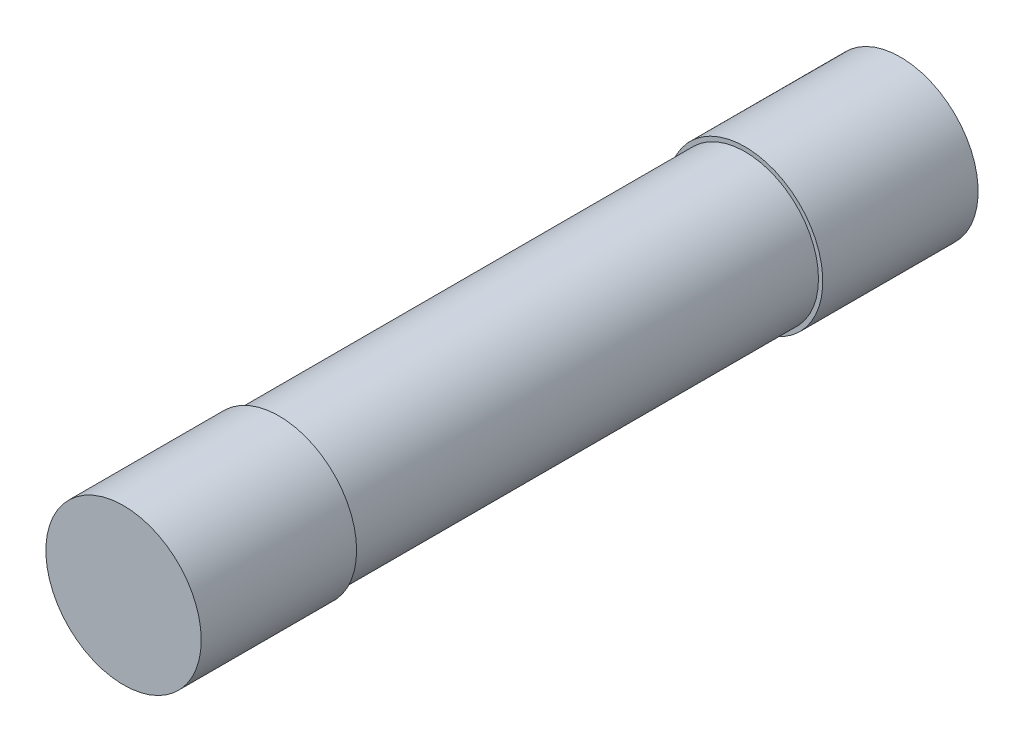
from build123d import *

# Parameters (mm, degrees)
SKETCH1_R           = 3.175
BOSS_EXTRUDE1_DEPTH = 6.35
SKETCH2_R           = 3
BOSS_EXTRUDE2_DEPTH = 19.05
SKETCH3_R           = 3.175
BOSS_EXTRUDE3_DEPTH = 6.35


with BuildPart() as part:
    # Sketch1 → Boss-Extrude1 (new body)
    with BuildSketch(Plane.XY):
        Circle(SKETCH1_R)
    extrude(amount=BOSS_EXTRUDE1_DEPTH)


with BuildPart() as body_2:
    # Sketch2 → Boss-Extrude2 (new body)
    with BuildSketch(Plane(origin=(0, 0, 0), x_dir=(-1, 0, 0), z_dir=(0, 0, -1))):
        with Locations(Location((0, 0, 0), (0, 0, 180))):
            Circle(SKETCH2_R)
    extrude(amount=BOSS_EXTRUDE2_DEPTH)


with BuildPart() as body_3:
    # Sketch3 → Boss-Extrude3 (new body)
    with BuildSketch(Plane(origin=(0, 0, -19.05), x_dir=(-1, 0, 0), z_dir=(0, 0, -1))):
        Circle(SKETCH3_R)
    extrude(amount=BOSS_EXTRUDE3_DEPTH)


solid = Compound([part.part, body_2.part, body_3.part])
